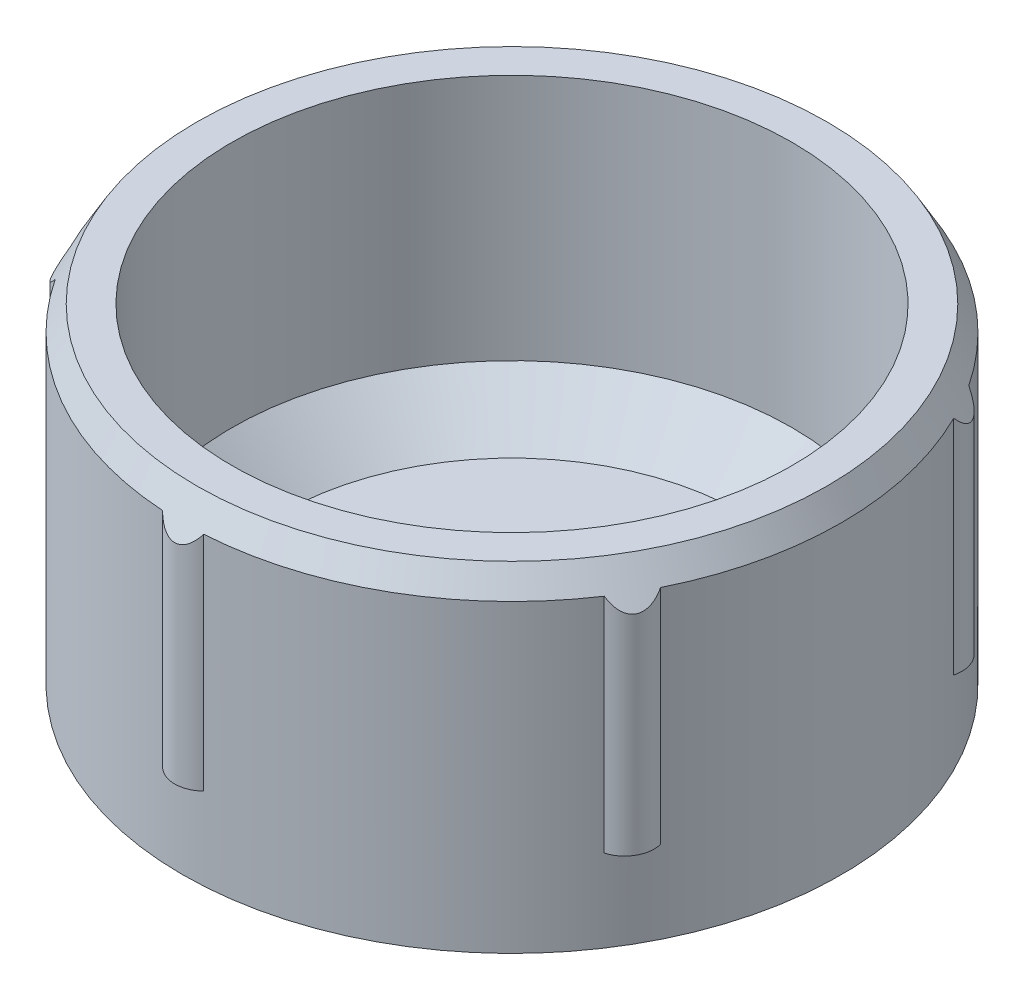
from build123d import *

# Parameters (mm, degrees)
BOSS_EXTRUDE1_DEPTH = 15
CUT_EXTRUDE1_REACH  = 35.809
SKETCH5_R           = 1.7
CHAMFER1_SIZE       = 3


with BuildPart() as part:
    # Sketch2 → Revolve1 (revolve)
    with BuildSketch(Plane.XY, mode=Mode.PRIVATE) as revolve1_sk:
        Polygon((0, 0), (-20, 0), (-20, 20), (-17, 20), (-17, 2), (0, 2), align=None)
    revolve(revolve1_sk.sketch.rotate(Axis((0, 0, 0), (0, 1, 0)), 270), axis=Axis((0, 0, 0), (0, 1, 0)))

    # Sketch3 → Boss-Extrude1 (add)
    with BuildSketch(Plane(origin=(0, 20, 0), x_dir=(1, 0, 0), z_dir=(0, 1, 0))):
        with BuildLine():
            ThreePointArc((-1.25, 19.960899278), (0, 20.47), (1.25, 19.960899278))
            ThreePointArc((1.25, 19.960899278), (0, 20), (-1.25, 19.960899278))
        make_face()
        with BuildLine():
            ThreePointArc((16.661645857, 11.062981394), (17.320508076, 10), (17.911645857, 8.897917884))
            ThreePointArc((17.911645857, 8.897917884), (17.727540015, 10.235), (16.661645857, 11.062981394))
        make_face()
        with BuildLine():
            ThreePointArc((17.911645857, -8.897917884), (17.320508076, -10), (16.661645857, -11.062981394))
            ThreePointArc((16.661645857, -11.062981394), (17.727540015, -10.235), (17.911645857, -8.897917884))
        make_face()
        with BuildLine():
            ThreePointArc((1.25, -19.960899278), (0, -20), (-1.25, -19.960899278))
            ThreePointArc((-1.25, -19.960899278), (0, -20.47), (1.25, -19.960899278))
        make_face()
        with BuildLine():
            ThreePointArc((-16.661645857, -11.062981394), (-17.320508076, -10), (-17.911645857, -8.897917884))
            ThreePointArc((-17.911645857, -8.897917884), (-17.727540015, -10.235), (-16.661645857, -11.062981394))
        make_face()
        with BuildLine():
            ThreePointArc((-17.911645857, 8.897917884), (-17.320508076, 10), (-16.661645857, 11.062981394))
            ThreePointArc((-16.661645857, 11.062981394), (-17.727540015, 10.235), (-17.911645857, 8.897917884))
        make_face()
    extrude(amount=-BOSS_EXTRUDE1_DEPTH)

    # Sketch4 → Cut-Revolve1 (revolve, cut)
    with BuildSketch(Plane.XY, mode=Mode.PRIVATE) as cut_revolve1_sk:
        Polygon((-21, 16.767949192), (-18.556624327, 21), (-21, 21), align=None)
    revolve(cut_revolve1_sk.sketch.rotate(Axis((0, 20, 0), (0, -1, 0)), 90), axis=Axis((0, 20, 0), (0, -1, 0)), mode=Mode.SUBTRACT)

    # Sketch5 → Cut-Extrude1 (cut, up to next)
    with BuildSketch(Plane(origin=(0, 2, 0), x_dir=(1, 0, 0), z_dir=(0, 1, 0)), mode=Mode.PRIVATE) as cut_extrude1_sk1:
        with Locations(Location((0, 9.5, 0), (0, 0, 270))):
            Circle(SKETCH5_R)
    cut_extrude1_tool1 = extrude(cut_extrude1_sk1.sketch, amount=-CUT_EXTRUDE1_REACH, mode=Mode.PRIVATE) & part.part
    # Sketch5 → Cut-Extrude1 (cut, up to next)
    with BuildSketch(Plane(origin=(0, 2, 0), x_dir=(1, 0, 0), z_dir=(0, 1, 0)), mode=Mode.PRIVATE) as cut_extrude1_sk2:
        with Locations(Location((8.227241336, -4.75, 0), (0, 0, 270))):
            Circle(SKETCH5_R)
    cut_extrude1_tool2 = extrude(cut_extrude1_sk2.sketch, amount=-CUT_EXTRUDE1_REACH, mode=Mode.PRIVATE) & part.part
    # Sketch5 → Cut-Extrude1 (cut, up to next)
    with BuildSketch(Plane(origin=(0, 2, 0), x_dir=(1, 0, 0), z_dir=(0, 1, 0)), mode=Mode.PRIVATE) as cut_extrude1_sk3:
        with Locations(Location((-8.227241336, -4.75, 0), (0, 0, 270))):
            Circle(SKETCH5_R)
    cut_extrude1_tool3 = extrude(cut_extrude1_sk3.sketch, amount=-CUT_EXTRUDE1_REACH, mode=Mode.PRIVATE) & part.part
    add(cut_extrude1_tool1.solids().sort_by_distance((0, 2, -9.5))[0], mode=Mode.SUBTRACT)
    add(cut_extrude1_tool2.solids().sort_by_distance((8.227241, 2, 4.75))[0], mode=Mode.SUBTRACT)
    add(cut_extrude1_tool3.solids().sort_by_distance((-8.227241, 2, 4.75))[0], mode=Mode.SUBTRACT)

    # Chamfer1
    chamfer1_edges = [part.edges().sort_by_distance(p)[0] for p in [
        (0, 2, 17),
    ]]
    chamfer(chamfer1_edges, length=CHAMFER1_SIZE)


solid = part.part
